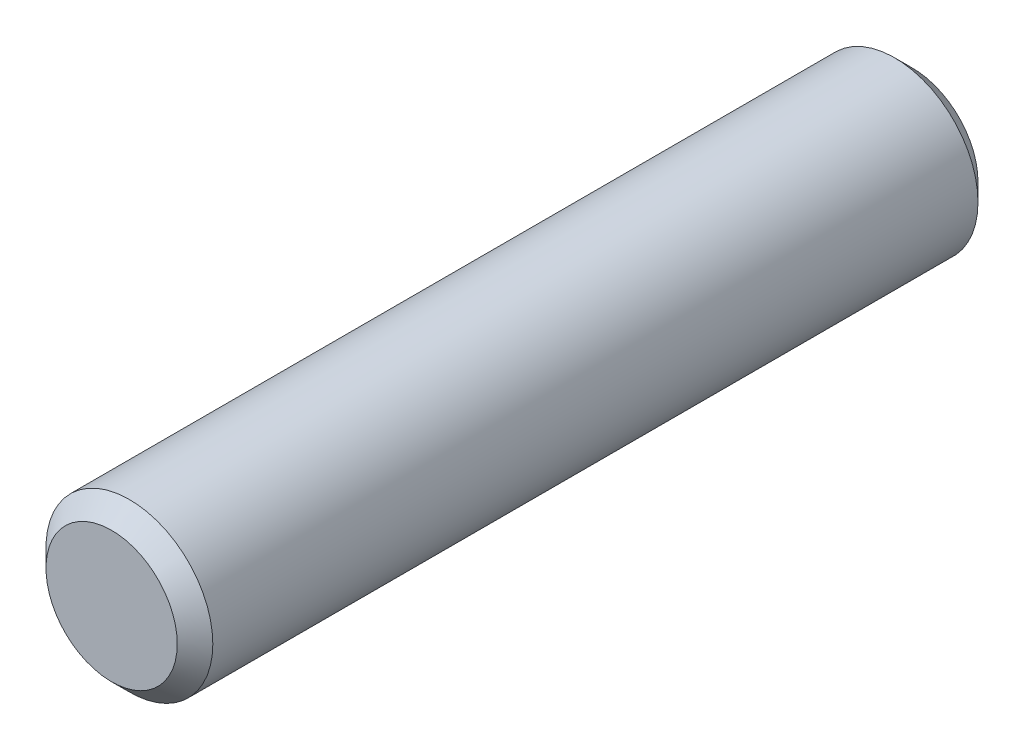
from build123d import *

# Parameters (mm, degrees)
SKETCH1_R      = 1.190625
EXTRUDE1_DEPTH = 5.715
CHAMFER1_SIZE  = 0.254


with BuildPart() as part:
    # Sketch1 → Extrude1 (new, symmetric)
    with BuildSketch(Plane.XY):
        Circle(SKETCH1_R)
    extrude(amount=EXTRUDE1_DEPTH, both=True)

    # Chamfer1
    chamfer1_edges = [part.edges().sort_by_distance(p)[0] for p in [
        (-1.190625, 0, -5.715),
        (-1.190625, 0, 5.715),
    ]]
    chamfer(chamfer1_edges, length=CHAMFER1_SIZE)


solid = part.part
